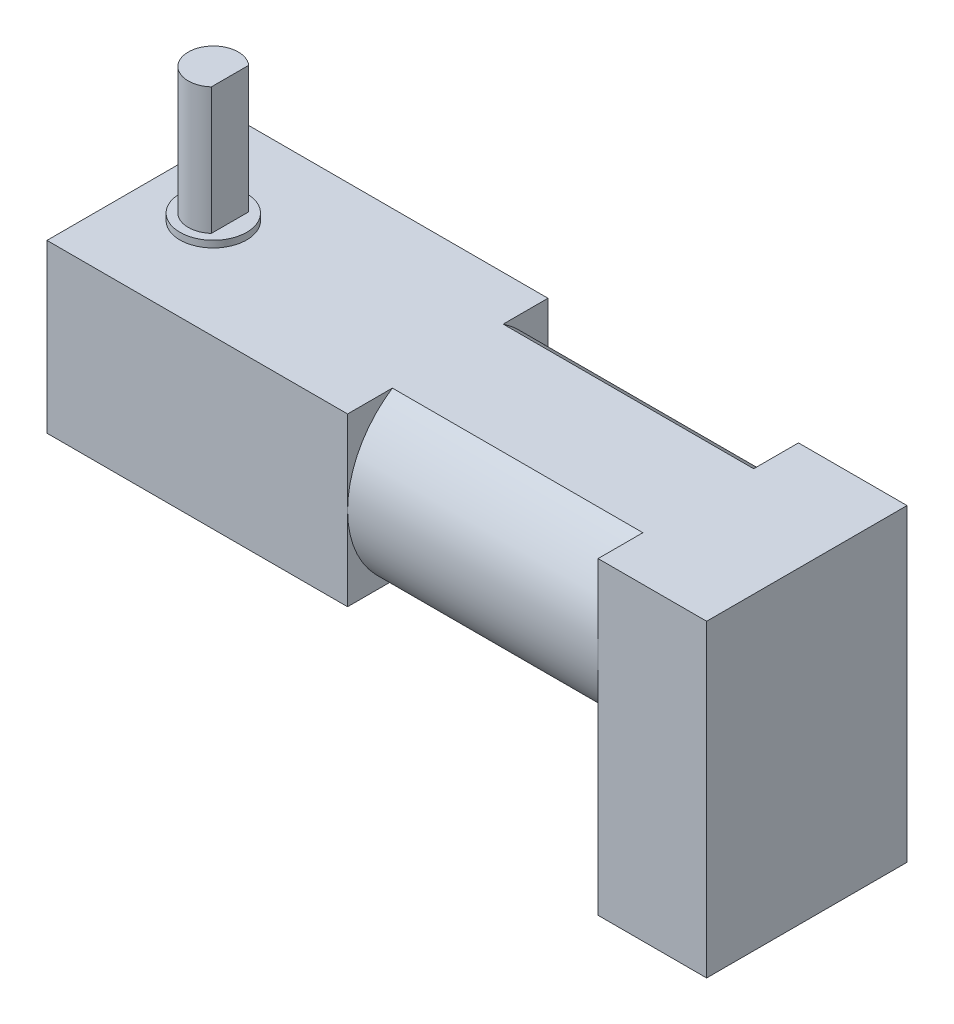
from build123d import *

# Parameters (mm, degrees)
SKETCH_1_W      = 18
SKETCH_1_H      = 12
EXTRUDE_1_DEPTH = 10
EXTRUDE_2_DEPTH = 15
SKETCH_3_R      = 2
EXTRUDE_3_DEPTH = 0.4
EXTRUDE_5_DEPTH = 7.6
SKETCH_5_W      = 12
SKETCH_5_H      = 18.5
EXTRUDE_6_DEPTH = 6.5


with BuildPart() as part:
    # 草图1 → 凸台-拉伸1 (new body)
    with BuildSketch(Plane(origin=(0, 0, 0), x_dir=(1, 0, 0), z_dir=(0, 1, 0))):
        with Locations((9, 6)):
            Rectangle(SKETCH_1_W, SKETCH_1_H)
    extrude(amount=EXTRUDE_1_DEPTH)

    # 草图2 → 凸台-拉伸2 (add)
    with BuildSketch(Plane(origin=(18, 0, 0), x_dir=(0, 0, -1), z_dir=(1, 0, 0))):
        with BuildLine():
            Line((2.68337521, 10), (9.31662479, 10))
            ThreePointArc((9.31662479, 10), (12, 5), (9.31662479, 0))
            Line((9.31662479, 0), (2.68337521, 0))
            ThreePointArc((2.68337521, 0), (0, 5), (2.68337521, 10))
        make_face()
    extrude(amount=EXTRUDE_2_DEPTH)

    # 草图3 → 凸台-拉伸3 (add)
    with BuildSketch(Plane(origin=(0, 10, 0), x_dir=(1, 0, 0), z_dir=(0, 1, 0))):
        with Locations(Location((3.96, 6, 0), (0, 0, 90))):
            Circle(SKETCH_3_R)
    extrude(amount=EXTRUDE_3_DEPTH)

    # 草图4 → 凸台-拉伸5 (add)
    with BuildSketch(Plane(origin=(0, 10.4, 0), x_dir=(1, 0, 0), z_dir=(0, 1, 0))):
        with BuildLine():
            Line((4.96, 4.881966011), (4.96, 7.118033989))
            ThreePointArc((4.96, 7.118033989), (2.46, 6), (4.96, 4.881966011))
        make_face()
    extrude(amount=EXTRUDE_5_DEPTH)

    # 草图5 → 凸台-拉伸6 (add)
    with BuildSketch(Plane(origin=(33, 0, 0), x_dir=(0, 0, -1), z_dir=(1, 0, 0))):
        with Locations((6, 0.75)):
            Rectangle(SKETCH_5_W, SKETCH_5_H)
    extrude(amount=EXTRUDE_6_DEPTH)


solid = part.part
